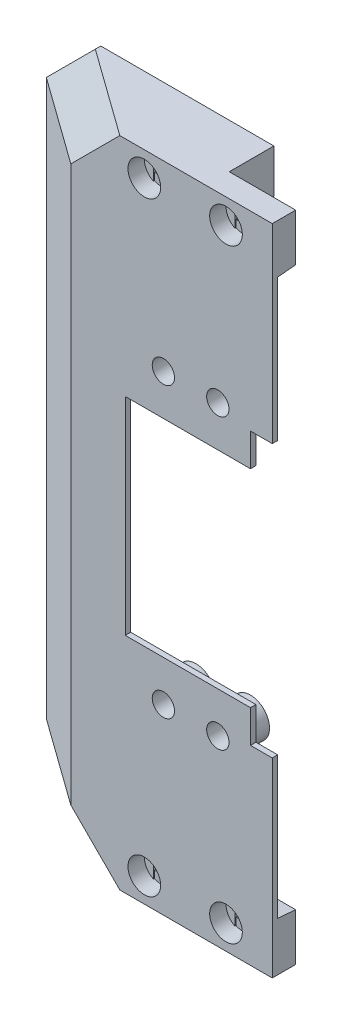
from build123d import *
from build123d.topology import SkipClean

# Parameters (mm, degrees)
BOSS_EXTRUDE1_DEPTH = 1
SKETCH7_W           = 4
SKETCH7_H           = 50
CUT_EXTRUDE1_DEPTH  = 106.49052105
SKETCH8_W           = 12.2
SKETCH8_H           = 5.2
CUT_EXTRUDE2_DEPTH  = 149.162917235
SKETCH9_R           = 1.35
CUT_EXTRUDE3_DEPTH  = 106.604214081
SKETCH10_R          = 3
CUT_EXTRUDE4_DEPTH  = 3
CUT_EXTRUDE8_DEPTH  = 0.2
SKETCH15_W          = 2.7
SKETCH15_H          = 2.7
CUT_EXTRUDE9_DEPTH  = 0.2
SKETCH16_R          = 2.05
CUT_EXTRUDE10_DEPTH = 106.49052105
BOSS_EXTRUDE2_START = 5
SKETCH17_R          = 3.5
SKETCH17_R_2        = 2.05
BOSS_EXTRUDE2_DEPTH = 5
FILLET1_R           = 1
SKETCH18_W          = 5
SKETCH18_H          = 22
CUT_EXTRUDE11_DEPTH = 106.49052105
CUT_EXTRUDE12_REACH = 150.163
SKETCH19_W          = 12.2
SKETCH19_H          = 3
CUT_EXTRUDE13_REACH = 150.163
SKETCH20_W          = 12.2
SKETCH20_H          = 3
SKETCH23_R          = 1.35
CUT_EXTRUDE14_DEPTH = 106.604214081
SKETCH24_R          = 3
CUT_EXTRUDE15_DEPTH = 3
CUT_EXTRUDE16_DEPTH = 0.2
SKETCH26_W          = 2.7
SKETCH26_H          = 2.7
CUT_EXTRUDE17_DEPTH = 0.2
SKETCH27_W          = 23
SKETCH27_H          = 38
CUT_EXTRUDE18_DEPTH = 106.49052105


with BuildPart() as part:
    # Sketch2 → Boss-Extrude1 (new body)
    with BuildSketch(Plane.XY):
        Polygon((-86, -51), (-77, -60), (-33, -60), (-33, 60), (-77, 60), (-86, 51), align=None)
    extrude(amount=BOSS_EXTRUDE1_DEPTH)

    # Sketch4 → Loft1 section 0
    with BuildSketch(Plane.XY.offset(1)):
        with BuildLine():
            Line((-86, 51), (-86, -51))
            Line((-86, -51), (-77, -60))
            Line((-77, -60), (-33, -60))
            Line((-33, -60), (-33, 60))
            Line((-33, 60), (-77, 60))
            Line((-77, 60), (-86, 51))
        make_face()
    # Sketch3 → Loft1 section 1
    with BuildSketch(Plane.XY.offset(12.5)):
        with BuildLine():
            Line((-33, 60), (-61, 60))
            Line((-61, 60), (-70, 51))
            Line((-70, 51), (-70, -51))
            Line((-70, -51), (-61, -60))
            Line((-61, -60), (-33, -60))
            Line((-33, -60), (-33, 60))
        make_face()
    loft()

    # Sketch6 → Cut-Loft1 section 0
    with BuildSketch(Plane.XY.offset(11.5)):
        with BuildLine():
            Line((-33, 51), (-64.343145751, 51))
            Line((-64.343145751, 51), (-66, 49.343145751))
            Line((-66, 49.343145751), (-66, -49.343145751))
            Line((-66, -49.343145751), (-64.343145751, -51))
            Line((-64.343145751, -51), (-33, -51))
            Line((-33, -51), (-33, 51))
        make_face()
    # Sketch5 → Cut-Loft1 section 1
    with BuildSketch(Plane(origin=(0, 0, 0), x_dir=(-1, 0, 0), z_dir=(0, 0, -1))):
        with BuildLine():
            Line((33, 52), (77, 52))
            Line((77, 52), (78, 51))
            Line((78, 51), (78, -51))
            Line((78, -51), (77, -52))
            Line((77, -52), (33, -52))
            Line((33, -52), (33, 52))
        make_face()
    loft(mode=Mode.SUBTRACT)

    # Sketch7 → Cut-Extrude1 (cut, through all)
    with BuildSketch(Plane(origin=(0, 0, 11.5), x_dir=(-1, 0, 0), z_dir=(0, 0, -1))):
        with Locations((35, 0)):
            Rectangle(SKETCH7_W, SKETCH7_H)
    extrude(amount=-CUT_EXTRUDE1_DEPTH, mode=Mode.SUBTRACT)

    # Sketch8 → Cut-Extrude2 (cut, through all)
    with BuildSketch(Plane.XZ.offset(60)):
        with Locations((-39.1, 2.6)):
            Rectangle(SKETCH8_W, SKETCH8_H)
    extrude(amount=-CUT_EXTRUDE2_DEPTH, mode=Mode.SUBTRACT)

    # Sketch9 → Cut-Extrude3 (cut, through all)
    with BuildSketch(Plane.XY.offset(12.5)):
        with Locations((-41.5, 55.5)):
            Circle(SKETCH9_R)
        with Locations((-41.5, -55.5)):
            Circle(SKETCH9_R)
    extrude(amount=-CUT_EXTRUDE3_DEPTH, mode=Mode.SUBTRACT)

    # Sketch10 → Cut-Extrude4 (cut)
    with BuildSketch(Plane.XY.offset(12.5)):
        with Locations((-41.5, 55.5)):
            Circle(SKETCH10_R)
        with Locations((-41.5, -55.5)):
            Circle(SKETCH10_R)
    extrude(amount=-CUT_EXTRUDE4_DEPTH, mode=Mode.SUBTRACT)

    # Sketch14 → Cut-Extrude8 (cut)
    with SkipClean():  # the faces are left unmerged after this step: merging them gives an invalid solid
        with BuildSketch(Plane.XY.offset(9.5)):
            with BuildLine():
                Line((-42.85, -58.179085665), (-42.85, -52.820914335))
                ThreePointArc((-42.85, -52.820914335), (-41.5, -52.5), (-40.15, -52.820914335))
                Line((-40.15, -52.820914335), (-40.15, -58.179085665))
                ThreePointArc((-40.15, -58.179085665), (-41.5, -58.5), (-42.85, -58.179085665))
            make_face()
        cut_extrude8 = extrude(amount=-CUT_EXTRUDE8_DEPTH, mode=Mode.SUBTRACT)

    # Sketch15 → Cut-Extrude9 (cut)
    with SkipClean():  # the faces are left unmerged after this step: merging them gives an invalid solid
        with BuildSketch(Plane.XY.offset(9.3)):
            with Locations((-41.5, -55.5)):
                Rectangle(SKETCH15_W, SKETCH15_H)
        cut_extrude9 = extrude(amount=-CUT_EXTRUDE9_DEPTH, mode=Mode.SUBTRACT)

    # Mirror1: Cut-Extrude8, Cut-Extrude9 across plane
    with SkipClean():  # the faces are left unmerged after this step: merging them gives an invalid solid
        add(cut_extrude8.mirror(Plane.ZX), mode=Mode.SUBTRACT)
        add(cut_extrude9.mirror(Plane.ZX), mode=Mode.SUBTRACT)

    # Sketch16 → Cut-Extrude10 (cut, through all)
    with SkipClean():  # the faces are left unmerged after this step: merging them gives an invalid solid
        with BuildSketch(Plane(origin=(0, 0, 11.5), x_dir=(-1, 0, 0), z_dir=(0, 0, -1))):
            with Locations((43, 26.5)):
                Circle(SKETCH16_R)
            with Locations((53, 26.5)):
                Circle(SKETCH16_R)
            with Locations((53, -26.5)):
                Circle(SKETCH16_R)
            with Locations((43, -26.5)):
                Circle(SKETCH16_R)
        extrude(amount=-CUT_EXTRUDE10_DEPTH, mode=Mode.SUBTRACT)

    # Sketch17 → Boss-Extrude2 (add)
    # profile 1 of 4: a face of its own
    with SkipClean():  # the faces are left unmerged after this step: merging them gives an invalid solid
        with BuildSketch(Plane(origin=(0, 0, 11.5), x_dir=(-1, 0, 0), z_dir=(0, 0, -1)).offset(BOSS_EXTRUDE2_START)):
            with Locations(Location((43, 26.5, 0), (0, 0, 180))):
                Circle(SKETCH17_R)
            with Locations((43, 26.5)):
                Circle(SKETCH17_R_2, mode=Mode.SUBTRACT)
        # profile 2 of 4: a face of its own
        with BuildSketch(Plane(origin=(0, 0, 11.5), x_dir=(-1, 0, 0), z_dir=(0, 0, -1)).offset(BOSS_EXTRUDE2_START)):
            with Locations(Location((53, 26.5, 0), (0, 0, 180))):
                Circle(SKETCH17_R)
            with Locations((53, 26.5)):
                Circle(SKETCH17_R_2, mode=Mode.SUBTRACT)
        # profile 3 of 4: a face of its own
        with BuildSketch(Plane(origin=(0, 0, 11.5), x_dir=(-1, 0, 0), z_dir=(0, 0, -1)).offset(BOSS_EXTRUDE2_START)):
            with Locations(Location((53, -26.5, 0), (0, 0, 180))):
                Circle(SKETCH17_R)
            with Locations((53, -26.5)):
                Circle(SKETCH17_R_2, mode=Mode.SUBTRACT)
        # profile 4 of 4: a face of its own
        with BuildSketch(Plane(origin=(0, 0, 11.5), x_dir=(-1, 0, 0), z_dir=(0, 0, -1)).offset(BOSS_EXTRUDE2_START)):
            with Locations(Location((43, -26.5, 0), (0, 0, 180))):
                Circle(SKETCH17_R)
            with Locations((43, -26.5)):
                Circle(SKETCH17_R_2, mode=Mode.SUBTRACT)
        extrude(amount=-BOSS_EXTRUDE2_DEPTH)

    # Fillet1
    fillet1_edges = [part.edges().sort_by_distance(p)[0] for p in [
        (-46.5, 26.5, 11.5),
        (-56.5, 26.5, 11.5),
        (-56.5, -26.5, 11.5),
        (-46.5, -26.5, 11.5),
    ]]
    fillet(fillet1_edges, radius=FILLET1_R)

    # Sketch18 → Cut-Extrude11 (cut, through all)
    with SkipClean():  # the faces are left unmerged after this step: merging them gives an invalid solid
        with BuildSketch(Plane(origin=(0, 0, 11.5), x_dir=(-1, 0, 0), z_dir=(0, 0, -1))):
            with Locations((39.5, 0)):
                Rectangle(SKETCH18_W, SKETCH18_H)
        extrude(amount=-CUT_EXTRUDE11_DEPTH, mode=Mode.SUBTRACT)

    # Cut-Extrude12: up to this plane
    with SkipClean():  # the faces are left unmerged after this step: merging them gives an invalid solid
        cut_extrude12_end = Plane(origin=(0, 51.609756098, 4.487804878), z_dir=(0, -0.9962405881956831, -0.08662961636484208))
        # Sketch19 → Cut-Extrude12 (cut, up to the surface)
        with BuildSketch(Plane(origin=(0, 60, 0), x_dir=(1, 0, 0), z_dir=(0, 1, 0)), mode=Mode.PRIVATE) as cut_extrude12_sk1:
            with Locations((-39.1, -6.7)):
                Rectangle(SKETCH19_W, SKETCH19_H)
        cut_extrude12_tool1 = split(extrude(cut_extrude12_sk1.sketch, amount=-CUT_EXTRUDE12_REACH, mode=Mode.PRIVATE), bisect_by=cut_extrude12_end, keep=Keep.BOTH, mode=Mode.PRIVATE)
        add(cut_extrude12_tool1.solids().sort_by_distance((-39.1, 60, 6.7))[0], mode=Mode.SUBTRACT)

    # Cut-Extrude13: up to this plane
    with SkipClean():  # the faces are left unmerged after this step: merging them gives an invalid solid
        cut_extrude13_end = Plane(origin=(0, -51.609756098, 4.487804878), z_dir=(0, -0.9962405881956831, 0.0866296163648415))
        # Sketch20 → Cut-Extrude13 (cut, up to the surface)
        with BuildSketch(Plane.XZ.offset(60), mode=Mode.PRIVATE) as cut_extrude13_sk1:
            with Locations((-39.1, 6.7)):
                Rectangle(SKETCH20_W, SKETCH20_H)
        cut_extrude13_tool1 = split(extrude(cut_extrude13_sk1.sketch, amount=-CUT_EXTRUDE13_REACH, mode=Mode.PRIVATE), bisect_by=cut_extrude13_end, keep=Keep.BOTH, mode=Mode.PRIVATE)
        add(cut_extrude13_tool1.solids().sort_by_distance((-39.1, -60, 6.7))[0], mode=Mode.SUBTRACT)

    # Sketch23 → Cut-Extrude14 (cut, symmetric)
    with SkipClean():  # the faces are left unmerged after this step: merging them gives an invalid solid
        with BuildSketch(Plane.XY.offset(12.5)):
            with Locations((-56.5, -55.5)):
                Circle(SKETCH23_R)
        cut_extrude14 = extrude(amount=CUT_EXTRUDE14_DEPTH, both=True, mode=Mode.SUBTRACT)

    # Sketch24 → Cut-Extrude15 (cut)
    with SkipClean():  # the faces are left unmerged after this step: merging them gives an invalid solid
        with BuildSketch(Plane.XY.offset(12.5)):
            with Locations((-56.5, -55.5)):
                Circle(SKETCH24_R)
        cut_extrude15 = extrude(amount=-CUT_EXTRUDE15_DEPTH, mode=Mode.SUBTRACT)

    # Sketch25 → Cut-Extrude16 (cut)
    with SkipClean():  # the faces are left unmerged after this step: merging them gives an invalid solid
        with BuildSketch(Plane.XY.offset(9.5)):
            with BuildLine():
                Line((-57.85, -58.179085665), (-57.85, -52.820914335))
                ThreePointArc((-57.85, -52.820914335), (-56.5, -52.5), (-55.15, -52.820914335))
                Line((-55.15, -52.820914335), (-55.15, -58.179085665))
                ThreePointArc((-55.15, -58.179085665), (-56.5, -58.5), (-57.85, -58.179085665))
            make_face()
        cut_extrude16 = extrude(amount=-CUT_EXTRUDE16_DEPTH, mode=Mode.SUBTRACT)

    # Sketch26 → Cut-Extrude17 (cut)
    with SkipClean():  # the faces are left unmerged after this step: merging them gives an invalid solid
        with BuildSketch(Plane.XY.offset(9.3)):
            with Locations((-56.5, -55.5)):
                Rectangle(SKETCH26_W, SKETCH26_H)
        cut_extrude17 = extrude(amount=-CUT_EXTRUDE17_DEPTH, mode=Mode.SUBTRACT)

    # Mirror2: Cut-Extrude14, Cut-Extrude15, Cut-Extrude16, Cut-Extrude17 across plane
    with SkipClean():  # the faces are left unmerged after this step: merging them gives an invalid solid
        add(cut_extrude14.mirror(Plane.ZX), mode=Mode.SUBTRACT)
        add(cut_extrude15.mirror(Plane.ZX), mode=Mode.SUBTRACT)
        add(cut_extrude16.mirror(Plane.ZX), mode=Mode.SUBTRACT)
        add(cut_extrude17.mirror(Plane.ZX), mode=Mode.SUBTRACT)

    # Sketch27 → Cut-Extrude18 (cut, through all)
    with SkipClean():  # the faces are left unmerged after this step: merging them gives an invalid solid
        with BuildSketch(Plane(origin=(0, 0, 11.5), x_dir=(-1, 0, 0), z_dir=(0, 0, -1))):
            with Locations((48.5, 0)):
                Rectangle(SKETCH27_W, SKETCH27_H)
        extrude(amount=-CUT_EXTRUDE18_DEPTH, mode=Mode.SUBTRACT)


solid = part.part
